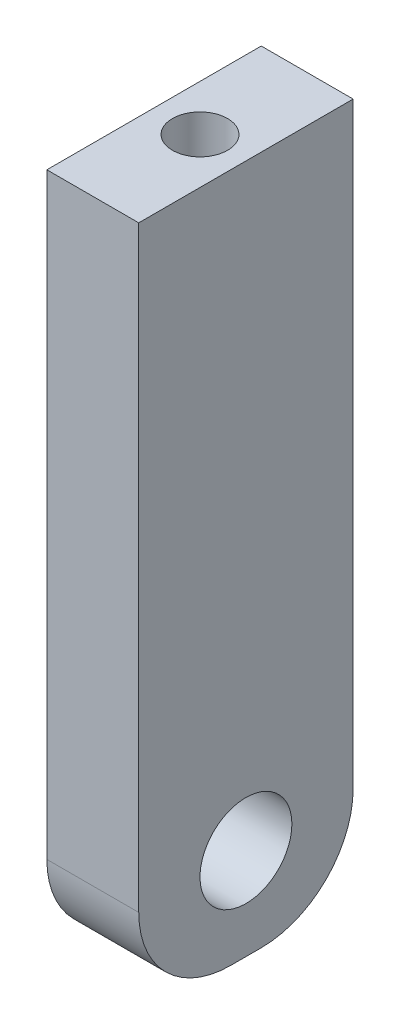
from build123d import *

# Parameters (mm, degrees)
SKETCH_1_W          = 3
SKETCH_1_H          = 22.5
EXTRUDE_1_DEPTH     = 7
SKETCH_4_R          = 1.5
CUT_EXTRUDE_2_DEPTH = 24.237188714
FILLET_1_R          = 3
SKETCH_3_R          = 0.9
CUT_EXTRUDE_4_DEPTH = 7


with BuildPart() as part:
    # 草图1 → 凸台-拉伸1 (new body)
    with BuildSketch(Plane.XY):
        with Locations((1.5, -10.703745451)):
            Rectangle(SKETCH_1_W, SKETCH_1_H)
    extrude(amount=EXTRUDE_1_DEPTH)

    # 草图4 → 切除-拉伸2 (cut, through all)
    with BuildSketch(Plane(origin=(3, 0, 0), x_dir=(0, 0, -1), z_dir=(1, 0, 0))):
        with Locations((-3.5, -18.953745451)):
            Circle(SKETCH_4_R)
    extrude(amount=-CUT_EXTRUDE_2_DEPTH, mode=Mode.SUBTRACT)

    # 圆角1
    fillet_1_edges = [part.edges().sort_by_distance(p)[0] for p in [
        (1.5, -21.953745451, 7),
        (1.5, -21.953745451, 0),
    ]]
    fillet(fillet_1_edges, radius=FILLET_1_R)

    # 草图3 → 切除-拉伸4 (cut)
    with BuildSketch(Plane(origin=(0, 0.546254549, 0), x_dir=(1, 0, 0), z_dir=(0, 1, 0))):
        with Locations(Location((1.5, -3.5, 0), (0, 0, 180))):
            Circle(SKETCH_3_R)
    extrude(amount=-CUT_EXTRUDE_4_DEPTH, mode=Mode.SUBTRACT)


solid = part.part
